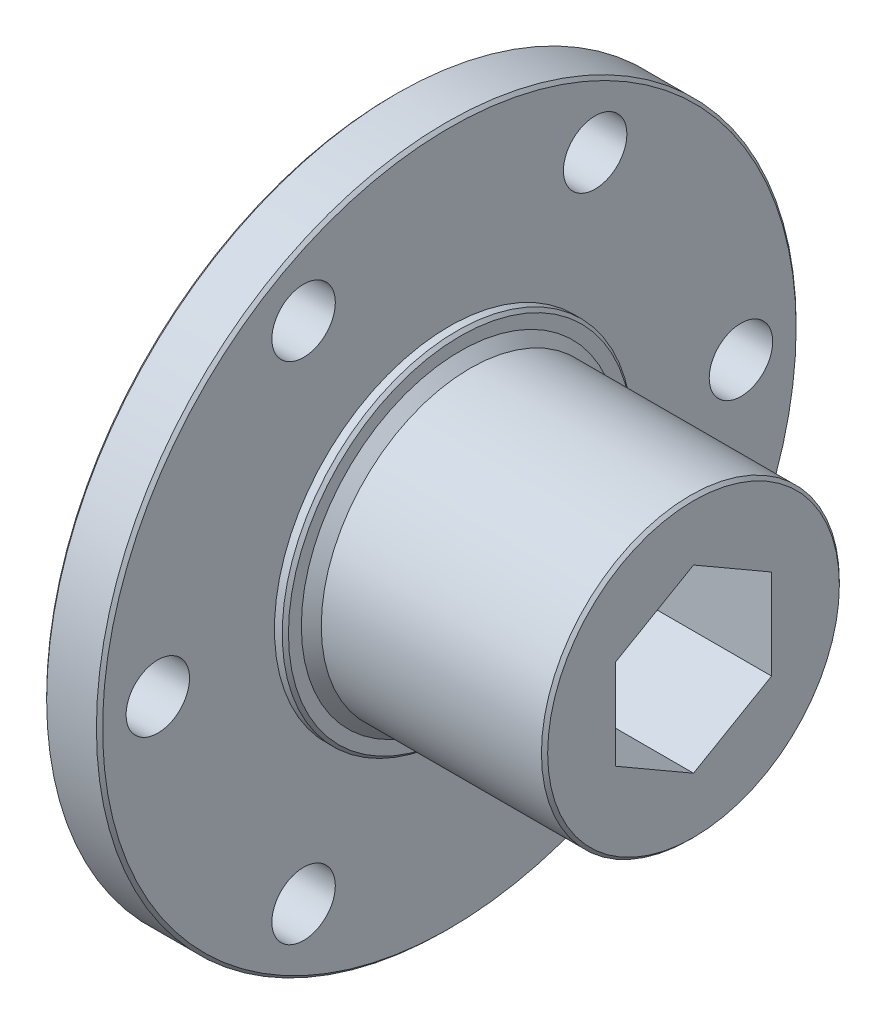
from build123d import *

# Parameters (mm, degrees)
SKETCH1_W                      = 4.572
SKETCH1_H                      = 28.575
SKETCH2_R                      = 14.2875
BOSS_EXTRUDE1_DEPTH            = 0.889
SKETCH3_R                      = 12.9794
BOSS_EXTRUDE2_DEPTH            = 0.8128
BOSS_EXTRUDE2_TAPER            = 45
SKETCH4_R                      = 12.1666
BOSS_EXTRUDE3_DEPTH            = 18.2372
BOSS_EXTRUDE4_START            = 0.889
SKETCH5_R                      = 14.2875
BOSS_EXTRUDE4_DEPTH            = 0.889
CUT_EXTRUDE1_DEPTH             = 48.730716001
F_6_0_204_DIAMETER_HOLE1_D     = 5.1816
F_6_0_204_DIAMETER_HOLE1_DEPTH = 24.511
CHAMFER1_SIZE                  = 0.254


with BuildPart() as part:
    # Sketch1 → Revolve1 (revolve)
    with BuildSketch(Plane(origin=(0, 0, 0), x_dir=(-1, 0, 0), z_dir=(0, 0, -1)), mode=Mode.PRIVATE) as revolve1_sk:
        with Locations((16.210066246, 14.2875)):
            Rectangle(SKETCH1_W, SKETCH1_H)
    revolve(revolve1_sk.sketch.rotate(Axis((-13.924066246, 0, 0), (-1, 0, 0)), 270), axis=Axis((-13.924066246, 0, 0), (-1, 0, 0)))

    # Sketch2 → Boss-Extrude1 (add)
    with BuildSketch(Plane(origin=(-13.924066246, 0, 0), x_dir=(0, 0, -1), z_dir=(1, 0, 0))):
        Circle(SKETCH2_R)
    extrude(amount=BOSS_EXTRUDE1_DEPTH)

    # Sketch3 → Boss-Extrude2 (add)
    with BuildSketch(Plane(origin=(-13.035066246, 0, 0), x_dir=(0, 0, -1), z_dir=(1, 0, 0))):
        Circle(SKETCH3_R)
    extrude(amount=BOSS_EXTRUDE2_DEPTH, taper=BOSS_EXTRUDE2_TAPER)

    # Sketch4 → Boss-Extrude3 (add)
    with BuildSketch(Plane(origin=(-12.222266246, 0, 0), x_dir=(0, 0, -1), z_dir=(1, 0, 0))):
        with Locations(Location((0, 0, 0), (0, 0, 180))):
            Circle(SKETCH4_R)
    extrude(amount=BOSS_EXTRUDE3_DEPTH)

    # Sketch5 → Boss-Extrude4 (add)
    with BuildSketch(Plane.ZY.offset(18.496066246).offset(BOSS_EXTRUDE4_START)):
        with Locations(Location((0, 0, 0), (0, 0, 180))):
            Circle(SKETCH5_R)
    extrude(amount=-BOSS_EXTRUDE4_DEPTH)

    # Sketch6 → Cut-Extrude1 (cut, through all)
    with BuildSketch(Plane.ZY.offset(19.385066246)):
        Polygon((0, 7.361657812), (-6.3754, 3.680818906), (-6.3754, -3.680858906), (0, -7.361697812), (6.3754, -3.680858906), (6.3754, 3.680818906), align=None)
    extrude(amount=-CUT_EXTRUDE1_DEPTH, mode=Mode.SUBTRACT)

    # #6 (0.204) Diameter Hole1
    with Locations(Plane.ZY.offset(18.496066246)):
        with Locations((11.90625, 20.622229928), (-23.8125, 0), (11.90625, -20.622229928), (-11.90625, -20.622229928), (-11.90625, 20.622229928), (23.8125, 0)):
            Hole(F_6_0_204_DIAMETER_HOLE1_D / 2, depth=F_6_0_204_DIAMETER_HOLE1_DEPTH)

    # Chamfer1
    chamfer1_edges = [part.edges().sort_by_distance(p)[0] for p in [
        (6.014933754, 0, -12.1666),
        (-19.385066246, 0, 14.2875),
        (-18.496066246, 0, -28.575),
        (-13.924066246, 0, -28.575),
        (-13.035066246, 0, 14.2875),
    ]]
    chamfer(chamfer1_edges, length=CHAMFER1_SIZE)


solid = part.part
